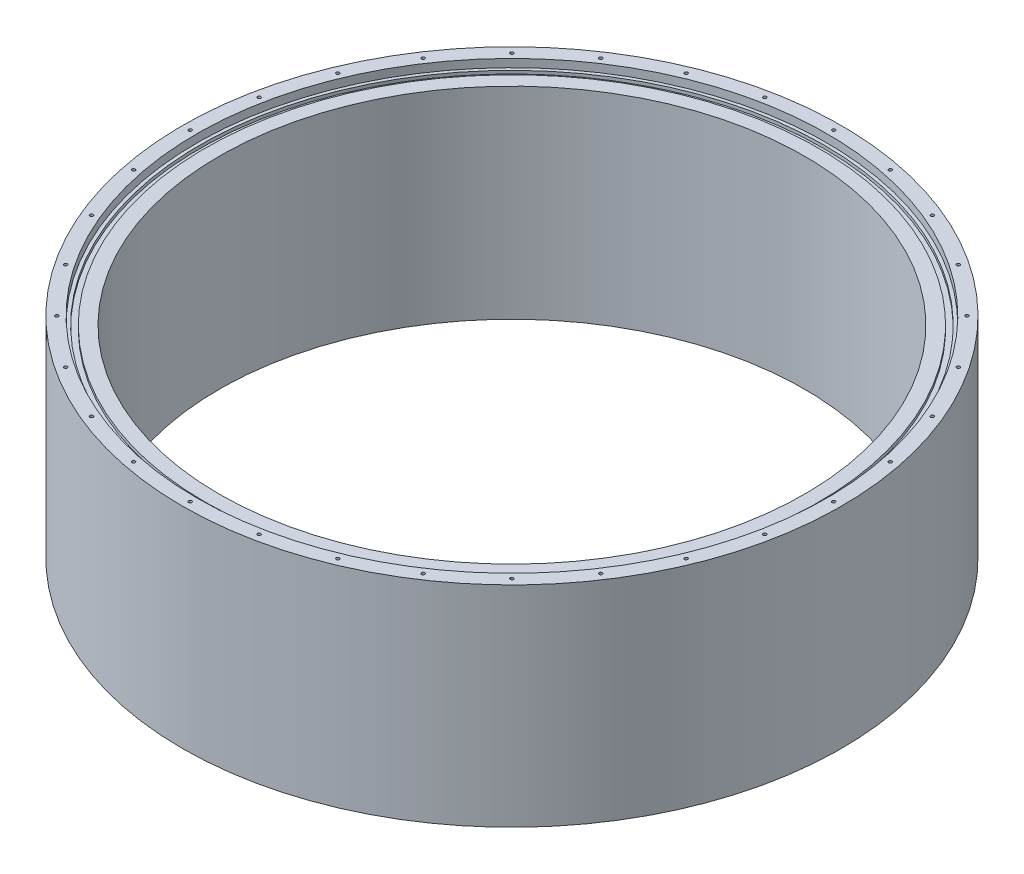
from build123d import *

# Parameters (mm, degrees)
SKETCH2_W                 = 4.1656
SKETCH2_H                 = 2.413
CIRPATTERN1_COUNT         = 32
F_5_0MM_DOWEL_HOLE1_D     = 5.05
F_5_0MM_DOWEL_HOLE1_DEPTH = 6
F_5_0MM_DOWEL_HOLE1_TIP   = 1.517173063


with BuildPart() as part:
    # Sketch1 → Revolve1 (revolve)
    with BuildSketch(Plane.XY, mode=Mode.PRIVATE) as revolve1_sk:
        Polygon((225.6, 74.685), (243, 74.685), (243, 80.885), (254, 80.885), (254, -80.885), (225.6, -80.885), align=None)
    revolve(revolve1_sk.sketch.rotate(Axis((0, 80.885, 0), (0, -1, 0)), 90), axis=Axis((0, 80.885, 0), (0, -1, 0)))

    # Sketch2 → Cut-Revolve1 (revolve, cut)
    with BuildSketch(Plane.XY, mode=Mode.PRIVATE) as cut_revolve1_sk:
        with Locations((238.4172, 73.4785)):
            Rectangle(SKETCH2_W, SKETCH2_H)
    revolve(cut_revolve1_sk.sketch.rotate(Axis((0, 80.885, 0), (0, -1, 0)), 90), axis=Axis((0, 80.885, 0), (0, -1, 0)), mode=Mode.SUBTRACT)

    # Sketch4 → M3x0.5 Tapped Hole1 (revolve, cut)
    with BuildSketch(Plane(origin=(248, 80.885, 0), x_dir=(0, 0, 1), z_dir=(1, 0, 0))):
        Polygon((0, 0), (0, 10.251075774), (1.25, 9.5), (1.25, 0), align=None)
    m3x0_5_tapped_hole1 = revolve(axis=Axis((248, 87.235, 0), (0, -1, 0)), mode=Mode.SUBTRACT)

    # CirPattern1: M3x0.5 Tapped Hole1 ×32 about axis
    cirpattern1_axis = Axis((0, 0, 0), (0, 1, 0))
    for i in range(1, CIRPATTERN1_COUNT):
        add(m3x0_5_tapped_hole1.rotate(cirpattern1_axis, i * 360 / CIRPATTERN1_COUNT), mode=Mode.SUBTRACT)

    # Mirror1: M3x0.5 Tapped Hole1 across plane
    add(m3x0_5_tapped_hole1.mirror(Plane.ZX), mode=Mode.SUBTRACT)

    # Mirror1 copy 1 sketch → Mirror1 copy 1 (revolve, cut)
    with BuildSketch(Plane(origin=(243.23474954, -80.885, -48.38239986), x_dir=(0.19509032201612825, 0, 0.9807852804032304), z_dir=(0.9807852804032304, 0, -0.19509032201612825))):
        Polygon((0, 0), (0, -10.251075774), (1.25, -9.5), (1.25, 0), align=None)
    revolve(axis=Axis((243.23474954, -87.235, -48.38239986), (0, -1, 0)), mode=Mode.SUBTRACT)

    # Mirror1 copy 2 sketch → Mirror1 copy 2 (revolve, cut)
    with BuildSketch(Plane(origin=(229.122124063, -80.885, -94.905491227), x_dir=(0.3826834323650898, 0, 0.9238795325112867), z_dir=(0.9238795325112867, 0, -0.3826834323650898))):
        Polygon((0, 0), (0, -10.251075774), (1.25, -9.5), (1.25, 0), align=None)
    revolve(axis=Axis((229.122124063, -87.235, -94.905491227), (0, -1, 0)), mode=Mode.SUBTRACT)

    # Mirror1 copy 3 sketch → Mirror1 copy 3 (revolve, cut)
    with BuildSketch(Plane(origin=(206.204463851, -80.885, -137.781417789), x_dir=(0.5555702330196022, 0, 0.8314696123025452), z_dir=(0.8314696123025452, 0, -0.5555702330196022))):
        Polygon((0, 0), (0, -10.251075774), (1.25, -9.5), (1.25, 0), align=None)
    revolve(axis=Axis((206.204463851, -87.235, -137.781417789), (0, -1, 0)), mode=Mode.SUBTRACT)

    # Mirror1 copy 4 sketch → Mirror1 copy 4 (revolve, cut)
    with BuildSketch(Plane(origin=(175.362481734, -80.885, -175.362481734), x_dir=(0.7071067811865475, 0, 0.7071067811865476), z_dir=(0.7071067811865476, 0, -0.7071067811865475))):
        Polygon((0, 0), (0, -10.251075774), (1.25, -9.5), (1.25, 0), align=None)
    revolve(axis=Axis((175.362481734, -87.235, -175.362481734), (0, -1, 0)), mode=Mode.SUBTRACT)

    # Mirror1 copy 5 sketch → Mirror1 copy 5 (revolve, cut)
    with BuildSketch(Plane(origin=(137.781417789, -80.885, -206.204463851), x_dir=(0.8314696123025452, 0, 0.5555702330196023), z_dir=(0.5555702330196023, 0, -0.8314696123025452))):
        Polygon((0, 0), (0, -10.251075774), (1.25, -9.5), (1.25, 0), align=None)
    revolve(axis=Axis((137.781417789, -87.235, -206.204463851), (0, -1, 0)), mode=Mode.SUBTRACT)

    # Mirror1 copy 6 sketch → Mirror1 copy 6 (revolve, cut)
    with BuildSketch(Plane(origin=(94.905491227, -80.885, -229.122124063), x_dir=(0.9238795325112867, 0, 0.38268343236508984), z_dir=(0.38268343236508984, 0, -0.9238795325112867))):
        Polygon((0, 0), (0, -10.251075774), (1.25, -9.5), (1.25, 0), align=None)
    revolve(axis=Axis((94.905491227, -87.235, -229.122124063), (0, -1, 0)), mode=Mode.SUBTRACT)

    # Mirror1 copy 7 sketch → Mirror1 copy 7 (revolve, cut)
    with BuildSketch(Plane(origin=(48.38239986, -80.885, -243.23474954), x_dir=(0.9807852804032304, 0, 0.19509032201612833), z_dir=(0.19509032201612833, 0, -0.9807852804032304))):
        Polygon((0, 0), (0, -10.251075774), (1.25, -9.5), (1.25, 0), align=None)
    revolve(axis=Axis((48.38239986, -87.235, -243.23474954), (0, -1, 0)), mode=Mode.SUBTRACT)

    # Mirror1 copy 8 sketch → Mirror1 copy 8 (revolve, cut)
    with BuildSketch(Plane(origin=(0, -80.885, -248), x_dir=(1, 0, 0), z_dir=(0, 0, -1))):
        Polygon((0, 0), (0, -10.251075774), (1.25, -9.5), (1.25, 0), align=None)
    revolve(axis=Axis((0, -87.235, -248), (0, -1, 0)), mode=Mode.SUBTRACT)

    # Mirror1 copy 9 sketch → Mirror1 copy 9 (revolve, cut)
    with BuildSketch(Plane(origin=(-48.38239986, -80.885, -243.23474954), x_dir=(0.9807852804032304, 0, -0.1950903220161282), z_dir=(-0.1950903220161282, 0, -0.9807852804032304))):
        Polygon((0, 0), (0, -10.251075774), (1.25, -9.5), (1.25, 0), align=None)
    revolve(axis=Axis((-48.38239986, -87.235, -243.23474954), (0, -1, 0)), mode=Mode.SUBTRACT)

    # Mirror1 copy 10 sketch → Mirror1 copy 10 (revolve, cut)
    with BuildSketch(Plane(origin=(-94.905491227, -80.885, -229.122124063), x_dir=(0.9238795325112867, 0, -0.3826834323650897), z_dir=(-0.3826834323650897, 0, -0.9238795325112867))):
        Polygon((0, 0), (0, -10.251075774), (1.25, -9.5), (1.25, 0), align=None)
    revolve(axis=Axis((-94.905491227, -87.235, -229.122124063), (0, -1, 0)), mode=Mode.SUBTRACT)

    # Mirror1 copy 11 sketch → Mirror1 copy 11 (revolve, cut)
    with BuildSketch(Plane(origin=(-137.781417789, -80.885, -206.204463851), x_dir=(0.8314696123025451, 0, -0.5555702330196023), z_dir=(-0.5555702330196023, 0, -0.8314696123025451))):
        Polygon((0, 0), (0, -10.251075774), (1.25, -9.5), (1.25, 0), align=None)
    revolve(axis=Axis((-137.781417789, -87.235, -206.204463851), (0, -1, 0)), mode=Mode.SUBTRACT)

    # Mirror1 copy 12 sketch → Mirror1 copy 12 (revolve, cut)
    with BuildSketch(Plane(origin=(-175.362481734, -80.885, -175.362481734), x_dir=(0.7071067811865476, 0, -0.7071067811865475), z_dir=(-0.7071067811865475, 0, -0.7071067811865476))):
        Polygon((0, 0), (0, -10.251075774), (1.25, -9.5), (1.25, 0), align=None)
    revolve(axis=Axis((-175.362481734, -87.235, -175.362481734), (0, -1, 0)), mode=Mode.SUBTRACT)

    # Mirror1 copy 13 sketch → Mirror1 copy 13 (revolve, cut)
    with BuildSketch(Plane(origin=(-206.204463851, -80.885, -137.781417789), x_dir=(0.5555702330196022, 0, -0.8314696123025453), z_dir=(-0.8314696123025453, 0, -0.5555702330196022))):
        Polygon((0, 0), (0, -10.251075774), (1.25, -9.5), (1.25, 0), align=None)
    revolve(axis=Axis((-206.204463851, -87.235, -137.781417789), (0, -1, 0)), mode=Mode.SUBTRACT)

    # Mirror1 copy 14 sketch → Mirror1 copy 14 (revolve, cut)
    with BuildSketch(Plane(origin=(-229.122124063, -80.885, -94.905491227), x_dir=(0.3826834323650899, 0, -0.9238795325112867), z_dir=(-0.9238795325112867, 0, -0.3826834323650899))):
        Polygon((0, 0), (0, -10.251075774), (1.25, -9.5), (1.25, 0), align=None)
    revolve(axis=Axis((-229.122124063, -87.235, -94.905491227), (0, -1, 0)), mode=Mode.SUBTRACT)

    # Mirror1 copy 15 sketch → Mirror1 copy 15 (revolve, cut)
    with BuildSketch(Plane(origin=(-243.23474954, -80.885, -48.38239986), x_dir=(0.19509032201612816, 0, -0.9807852804032304), z_dir=(-0.9807852804032304, 0, -0.19509032201612816))):
        Polygon((0, 0), (0, -10.251075774), (1.25, -9.5), (1.25, 0), align=None)
    revolve(axis=Axis((-243.23474954, -87.235, -48.38239986), (0, -1, 0)), mode=Mode.SUBTRACT)

    # Mirror1 copy 16 sketch → Mirror1 copy 16 (revolve, cut)
    with BuildSketch(Plane(origin=(-248, -80.885, 0), x_dir=(0, 0, -1), z_dir=(-1, 0, 0))):
        Polygon((0, 0), (0, -10.251075774), (1.25, -9.5), (1.25, 0), align=None)
    revolve(axis=Axis((-248, -87.235, 0), (0, -1, 0)), mode=Mode.SUBTRACT)

    # Mirror1 copy 17 sketch → Mirror1 copy 17 (revolve, cut)
    with BuildSketch(Plane(origin=(-243.23474954, -80.885, 48.38239986), x_dir=(-0.19509032201612836, 0, -0.9807852804032304), z_dir=(-0.9807852804032304, 0, 0.19509032201612836))):
        Polygon((0, 0), (0, -10.251075774), (1.25, -9.5), (1.25, 0), align=None)
    revolve(axis=Axis((-243.23474954, -87.235, 48.38239986), (0, -1, 0)), mode=Mode.SUBTRACT)

    # Mirror1 copy 18 sketch → Mirror1 copy 18 (revolve, cut)
    with BuildSketch(Plane(origin=(-229.122124063, -80.885, 94.905491227), x_dir=(-0.38268343236508967, 0, -0.9238795325112868), z_dir=(-0.9238795325112868, 0, 0.38268343236508967))):
        Polygon((0, 0), (0, -10.251075774), (1.25, -9.5), (1.25, 0), align=None)
    revolve(axis=Axis((-229.122124063, -87.235, 94.905491227), (0, -1, 0)), mode=Mode.SUBTRACT)

    # Mirror1 copy 19 sketch → Mirror1 copy 19 (revolve, cut)
    with BuildSketch(Plane(origin=(-206.204463851, -80.885, 137.781417789), x_dir=(-0.5555702330196023, 0, -0.8314696123025452), z_dir=(-0.8314696123025452, 0, 0.5555702330196023))):
        Polygon((0, 0), (0, -10.251075774), (1.25, -9.5), (1.25, 0), align=None)
    revolve(axis=Axis((-206.204463851, -87.235, 137.781417789), (0, -1, 0)), mode=Mode.SUBTRACT)

    # Mirror1 copy 20 sketch → Mirror1 copy 20 (revolve, cut)
    with BuildSketch(Plane(origin=(-175.362481734, -80.885, 175.362481734), x_dir=(-0.7071067811865475, 0, -0.7071067811865477), z_dir=(-0.7071067811865477, 0, 0.7071067811865475))):
        Polygon((0, 0), (0, -10.251075774), (1.25, -9.5), (1.25, 0), align=None)
    revolve(axis=Axis((-175.362481734, -87.235, 175.362481734), (0, -1, 0)), mode=Mode.SUBTRACT)

    # Mirror1 copy 21 sketch → Mirror1 copy 21 (revolve, cut)
    with BuildSketch(Plane(origin=(-137.781417789, -80.885, 206.204463851), x_dir=(-0.8314696123025452, 0, -0.5555702330196022), z_dir=(-0.5555702330196022, 0, 0.8314696123025452))):
        Polygon((0, 0), (0, -10.251075774), (1.25, -9.5), (1.25, 0), align=None)
    revolve(axis=Axis((-137.781417789, -87.235, 206.204463851), (0, -1, 0)), mode=Mode.SUBTRACT)

    # Mirror1 copy 22 sketch → Mirror1 copy 22 (revolve, cut)
    with BuildSketch(Plane(origin=(-94.905491227, -80.885, 229.122124063), x_dir=(-0.9238795325112868, 0, -0.3826834323650895), z_dir=(-0.3826834323650895, 0, 0.9238795325112868))):
        Polygon((0, 0), (0, -10.251075774), (1.25, -9.5), (1.25, 0), align=None)
    revolve(axis=Axis((-94.905491227, -87.235, 229.122124063), (0, -1, 0)), mode=Mode.SUBTRACT)

    # Mirror1 copy 23 sketch → Mirror1 copy 23 (revolve, cut)
    with BuildSketch(Plane(origin=(-48.38239986, -80.885, 243.23474954), x_dir=(-0.9807852804032303, 0, -0.19509032201612866), z_dir=(-0.19509032201612866, 0, 0.9807852804032303))):
        Polygon((0, 0), (0, -10.251075774), (1.25, -9.5), (1.25, 0), align=None)
    revolve(axis=Axis((-48.38239986, -87.235, 243.23474954), (0, -1, 0)), mode=Mode.SUBTRACT)

    # Mirror1 copy 24 sketch → Mirror1 copy 24 (revolve, cut)
    with BuildSketch(Plane(origin=(0, -80.885, 248), x_dir=(-1, 0, 0), z_dir=(0, 0, 1))):
        Polygon((0, 0), (0, -10.251075774), (1.25, -9.5), (1.25, 0), align=None)
    revolve(axis=Axis((0, -87.235, 248), (0, -1, 0)), mode=Mode.SUBTRACT)

    # Mirror1 copy 25 sketch → Mirror1 copy 25 (revolve, cut)
    with BuildSketch(Plane(origin=(48.38239986, -80.885, 243.23474954), x_dir=(-0.9807852804032304, 0, 0.1950903220161283), z_dir=(0.1950903220161283, 0, 0.9807852804032304))):
        Polygon((0, 0), (0, -10.251075774), (1.25, -9.5), (1.25, 0), align=None)
    revolve(axis=Axis((48.38239986, -87.235, 243.23474954), (0, -1, 0)), mode=Mode.SUBTRACT)

    # Mirror1 copy 26 sketch → Mirror1 copy 26 (revolve, cut)
    with BuildSketch(Plane(origin=(94.905491227, -80.885, 229.122124063), x_dir=(-0.9238795325112866, 0, 0.38268343236509), z_dir=(0.38268343236509, 0, 0.9238795325112866))):
        Polygon((0, 0), (0, -10.251075774), (1.25, -9.5), (1.25, 0), align=None)
    revolve(axis=Axis((94.905491227, -87.235, 229.122124063), (0, -1, 0)), mode=Mode.SUBTRACT)

    # Mirror1 copy 27 sketch → Mirror1 copy 27 (revolve, cut)
    with BuildSketch(Plane(origin=(137.781417789, -80.885, 206.204463851), x_dir=(-0.8314696123025455, 0, 0.5555702330196018), z_dir=(0.5555702330196018, 0, 0.8314696123025455))):
        Polygon((0, 0), (0, -10.251075774), (1.25, -9.5), (1.25, 0), align=None)
    revolve(axis=Axis((137.781417789, -87.235, 206.204463851), (0, -1, 0)), mode=Mode.SUBTRACT)

    # Mirror1 copy 28 sketch → Mirror1 copy 28 (revolve, cut)
    with BuildSketch(Plane(origin=(175.362481734, -80.885, 175.362481734), x_dir=(-0.7071067811865477, 0, 0.7071067811865474), z_dir=(0.7071067811865474, 0, 0.7071067811865477))):
        Polygon((0, 0), (0, -10.251075774), (1.25, -9.5), (1.25, 0), align=None)
    revolve(axis=Axis((175.362481734, -87.235, 175.362481734), (0, -1, 0)), mode=Mode.SUBTRACT)

    # Mirror1 copy 29 sketch → Mirror1 copy 29 (revolve, cut)
    with BuildSketch(Plane(origin=(206.204463851, -80.885, 137.781417789), x_dir=(-0.5555702330196022, 0, 0.8314696123025452), z_dir=(0.8314696123025452, 0, 0.5555702330196022))):
        Polygon((0, 0), (0, -10.251075774), (1.25, -9.5), (1.25, 0), align=None)
    revolve(axis=Axis((206.204463851, -87.235, 137.781417789), (0, -1, 0)), mode=Mode.SUBTRACT)

    # Mirror1 copy 30 sketch → Mirror1 copy 30 (revolve, cut)
    with BuildSketch(Plane(origin=(229.122124063, -80.885, 94.905491227), x_dir=(-0.38268343236508956, 0, 0.9238795325112868), z_dir=(0.9238795325112868, 0, 0.38268343236508956))):
        Polygon((0, 0), (0, -10.251075774), (1.25, -9.5), (1.25, 0), align=None)
    revolve(axis=Axis((229.122124063, -87.235, 94.905491227), (0, -1, 0)), mode=Mode.SUBTRACT)

    # Mirror1 copy 31 sketch → Mirror1 copy 31 (revolve, cut)
    with BuildSketch(Plane(origin=(243.23474954, -80.885, 48.38239986), x_dir=(-0.19509032201612872, 0, 0.9807852804032303), z_dir=(0.9807852804032303, 0, 0.19509032201612872))):
        Polygon((0, 0), (0, -10.251075774), (1.25, -9.5), (1.25, 0), align=None)
    revolve(axis=Axis((243.23474954, -87.235, 48.38239986), (0, -1, 0)), mode=Mode.SUBTRACT)

    # Ø5.0mm Dowel Hole1
    with Locations(Plane(origin=(0, -80.885, 0), x_dir=(-1, 0, 0), z_dir=(0, -1, 0))):
        with Locations((24.210233661, -245.810627488), (-24.210233661, 245.810627488)):
            Hole(F_5_0MM_DOWEL_HOLE1_D / 2, depth=F_5_0MM_DOWEL_HOLE1_DEPTH)
            with Locations((0, 0, -(F_5_0MM_DOWEL_HOLE1_DEPTH + F_5_0MM_DOWEL_HOLE1_TIP / 2))):  # 118° drill point
                Cone(0, F_5_0MM_DOWEL_HOLE1_D / 2, F_5_0MM_DOWEL_HOLE1_TIP, mode=Mode.SUBTRACT)


solid = part.part
